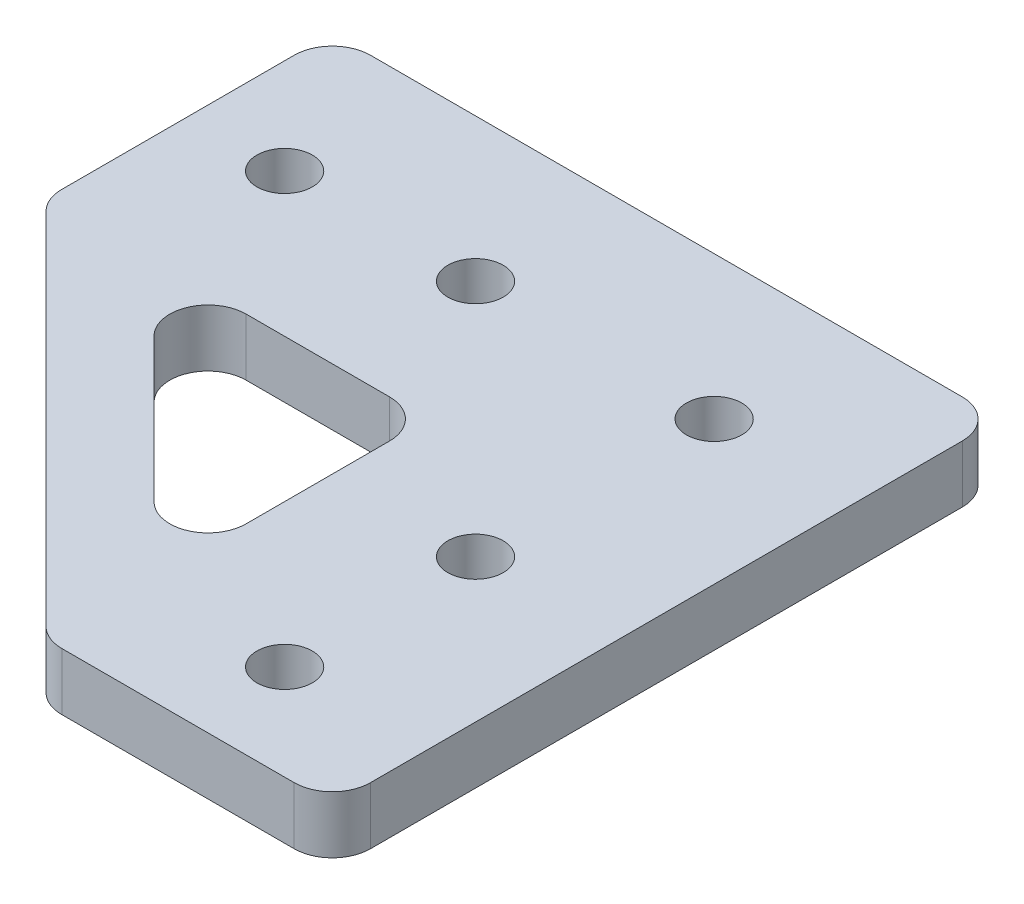
from build123d import *

# Parameters (mm, degrees)
SKETCH_1_R      = 1.45
EXTRUDE_1_DEPTH = 3
EXTRUDE_2_DEPTH = 3
FILLET_1_R      = 2


with BuildPart() as part:
    # 草图1 → 凸台-拉伸1 (new body)
    with BuildSketch(Plane(origin=(0, 0, 0), x_dir=(1, 0, 0), z_dir=(0, 1, 0))):
        Polygon((0, 0), (-35, 0), (-35, -15), (-15, -15), (-15, -35), (0, -35), align=None)
        with Locations(Location((-7.5, -7.5, 0), (0, 0, 270))):
            Circle(SKETCH_1_R, mode=Mode.SUBTRACT)
        with Locations(Location((-20, -7.5, 0), (0, 0, 270))):
            Circle(SKETCH_1_R, mode=Mode.SUBTRACT)
        with Locations(Location((-30, -7.5, 0), (0, 0, 270))):
            Circle(SKETCH_1_R, mode=Mode.SUBTRACT)
        with Locations(Location((-7.5, -20, 0), (0, 0, 270))):
            Circle(SKETCH_1_R, mode=Mode.SUBTRACT)
        with Locations(Location((-7.5, -30, 0), (0, 0, 270))):
            Circle(SKETCH_1_R, mode=Mode.SUBTRACT)
    extrude(amount=EXTRUDE_1_DEPTH)

    # 草图2 → 凸台-拉伸2 (add)
    with BuildSketch(Plane(origin=(0, 3, 0), x_dir=(1, 0, 0), z_dir=(0, 1, 0))):
        Polygon((-35, -15), (-15, -35), (-15, -29.343145751), (-29.343145751, -15), align=None)
    extrude(amount=-EXTRUDE_2_DEPTH)

    # 圆角1
    fillet_1_edges = [part.edges().sort_by_distance(p)[0] for p in [
        (0, 1.5, 35),
        (-15, 1.5, 35),
        (-15, 1.5, 15),
        (-35, 1.5, 15),
        (-35, 1.5, 0),
        (0, 1.5, 0),
        (-29.343145751, 1.5, 15),
        (-15, 1.5, 29.343145751),
    ]]
    fillet(fillet_1_edges, radius=FILLET_1_R)


solid = part.part
